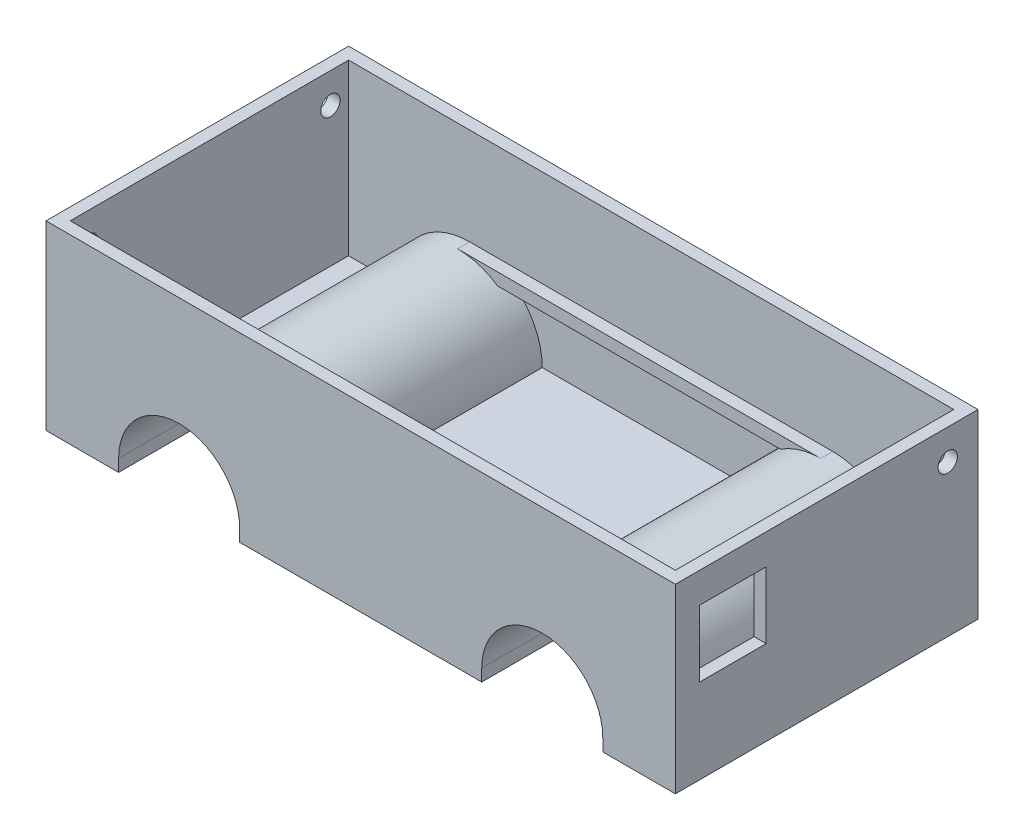
from build123d import *

# Parameters (mm, degrees)
AUFSATZ_LINEAR_AUSTRAGEN1_DEPTH = 50
SKIZZE3_W                       = 104
SKIZZE3_H                       = 2
AUFSATZ_LINEAR_AUSTRAGEN2_DEPTH = 28
SKIZZE4_W                       = 2
SKIZZE4_H                       = 48
AUFSATZ_LINEAR_AUSTRAGEN3_DEPTH = 28
SKIZZE6_W                       = 102
SKIZZE6_H                       = 2
AUFSATZ_LINEAR_AUSTRAGEN4_DEPTH = 28
SKIZZE7_W                       = 2
SKIZZE7_H                       = 46
AUFSATZ_LINEAR_AUSTRAGEN5_DEPTH = 28
SCHNITT_LINEAR_AUSTRAGEN1_DEPTH = 124.501835451
SKIZZE9_W                       = 11
SKIZZE9_H                       = 11
SCHNITT_LINEAR_AUSTRAGEN2_DEPTH = 5
SKIZZE10_W                      = 61.217018751
SKIZZE10_H                      = 2
AUFSATZ_LINEAR_AUSTRAGEN6_DEPTH = 2
SKIZZE11_W                      = 60
SKIZZE11_H                      = 2
AUFSATZ_LINEAR_AUSTRAGEN7_DEPTH = 2
SKIZZE12_R                      = 1.6
SCHNITT_LINEAR_AUSTRAGEN3_DEPTH = 61
SCHNITT_LINEAR_START            = -61
SKIZZE13_R                      = 1.6
SCHNITT_LINEAR_AUSTRAGEN4_DEPTH = 61
SKIZZE14_W                      = 0.314102564
SKIZZE14_H                      = 3.5
SKIZZE14_W_2                    = 1.346153846
SKIZZE14_H_2                    = 0.358974359
SCHNITT_LINEAR_AUSTRAGEN5_DEPTH = 0.5


with BuildPart() as part:
    # Skizze1 → Aufsatz-Linear austragen1 (new body)
    with BuildSketch(Plane.XY):
        with BuildLine():
            Line((37.401569275, 0), (37.401569275, -2))
            Line((37.401569275, -2), (77.401569275, -2))
            Line((77.401569275, -2), (77.401569275, 0))
            ThreePointArc((77.401569275, 0), (87.401569275, 10), (97.401569275, 0))
            Line((97.401569275, 0), (97.401569275, -2))
            Line((97.401569275, -2), (109.401569275, -2))
            Line((109.401569275, -2), (109.401569275, 0))
            Line((109.401569275, 0), (99.401569275, 0))
            ThreePointArc((99.401569275, 0), (87.401569275, 12), (75.401569275, 0))
            Line((75.401569275, 0), (39.401569275, 0))
            ThreePointArc((39.401569275, 0), (27.401569275, 12), (15.401569275, 0))
            Line((15.401569275, 0), (5.401569275, 0))
            Line((5.401569275, 0), (5.401569275, -2))
            Line((5.401569275, -2), (17.401569275, -2))
            Line((17.401569275, -2), (17.401569275, 0))
            ThreePointArc((17.401569275, 0), (27.401569275, 10), (37.401569275, 0))
        make_face()
    extrude(amount=AUFSATZ_LINEAR_AUSTRAGEN1_DEPTH)

    # Skizze3 → Aufsatz-Linear austragen2 (add)
    with BuildSketch(Plane(origin=(0, 0, 0), x_dir=(1, 0, 0), z_dir=(0, 1, 0))):
        with Locations((57.401569275, -1)):
            Rectangle(SKIZZE3_W, SKIZZE3_H)
    extrude(amount=AUFSATZ_LINEAR_AUSTRAGEN2_DEPTH)

    # Skizze4 → Aufsatz-Linear austragen3 (add)
    with BuildSketch(Plane(origin=(0, 0, 0), x_dir=(1, 0, 0), z_dir=(0, 1, 0))):
        with Locations((6.401569275, -26)):
            Rectangle(SKIZZE4_W, SKIZZE4_H)
    extrude(amount=AUFSATZ_LINEAR_AUSTRAGEN3_DEPTH)

    # Skizze6 → Aufsatz-Linear austragen4 (add)
    with BuildSketch(Plane(origin=(0, 0, 0), x_dir=(1, 0, 0), z_dir=(0, 1, 0))):
        with Locations((58.401569275, -49)):
            Rectangle(SKIZZE6_W, SKIZZE6_H)
    extrude(amount=AUFSATZ_LINEAR_AUSTRAGEN4_DEPTH)

    # Skizze7 → Aufsatz-Linear austragen5 (add)
    with BuildSketch(Plane(origin=(0, 0, 0), x_dir=(1, 0, 0), z_dir=(0, 1, 0))):
        with Locations((108.401569275, -25)):
            Rectangle(SKIZZE7_W, SKIZZE7_H)
    extrude(amount=AUFSATZ_LINEAR_AUSTRAGEN5_DEPTH)

    # Skizze8 → Schnitt-Linear austragen1 (cut, through all)
    with BuildSketch(Plane.XY.offset(50)):
        with BuildLine():
            Line((77.401569275, 0), (97.401569275, 0))
            ThreePointArc((97.401569275, 0), (87.401569275, 10), (77.401569275, 0))
        make_face()
        with BuildLine():
            Line((17.401569275, 0), (37.401569275, 0))
            ThreePointArc((37.401569275, 0), (27.401569275, 10), (17.401569275, 0))
        make_face()
    extrude(amount=-SCHNITT_LINEAR_AUSTRAGEN1_DEPTH, mode=Mode.SUBTRACT)

    # Skizze9 → Schnitt-Linear austragen2 (cut)
    with BuildSketch(Plane(origin=(109.401569275, 0, 0), x_dir=(0, 0, -1), z_dir=(1, 0, 0))):
        with Locations((-40.5, 17.5)):
            Rectangle(SKIZZE9_W, SKIZZE9_H)
    extrude(amount=-SCHNITT_LINEAR_AUSTRAGEN2_DEPTH, mode=Mode.SUBTRACT)

    # Skizze10 → Aufsatz-Linear austragen6 (add)
    with BuildSketch(Plane(origin=(0, 0, 48), x_dir=(-1, 0, 0), z_dir=(0, 0, -1))):
        with Locations((-56.7930599, 11)):
            Rectangle(SKIZZE10_W, SKIZZE10_H)
    extrude(amount=AUFSATZ_LINEAR_AUSTRAGEN6_DEPTH)

    # Skizze11 → Aufsatz-Linear austragen7 (add)
    with BuildSketch(Plane.XY.offset(2)):
        with Locations((57.401569275, 11)):
            Rectangle(SKIZZE11_W, SKIZZE11_H)
    extrude(amount=AUFSATZ_LINEAR_AUSTRAGEN7_DEPTH)

    # Skizze12 → Schnitt-Linear austragen3 (cut)
    with BuildSketch(Plane.ZY.offset(-5.401569275)):
        with Locations(Location((5, 23, 0), (0, 0, 270))):
            Circle(SKIZZE12_R)
        with Locations(Location((45, 23, 0), (0, 0, 270))):
            Circle(SKIZZE12_R)
    extrude(amount=-SCHNITT_LINEAR_AUSTRAGEN3_DEPTH, mode=Mode.SUBTRACT)

    # Skizze13 → Schnitt-Linear austragen4 (cut)
    with BuildSketch(Plane(origin=(109.401569275, 0, 0), x_dir=(0, 0, -1), z_dir=(1, 0, 0)).offset(SCHNITT_LINEAR_START)):
        with Locations(Location((-5, 23, 0), (0, 0, 270))):
            Circle(SKIZZE13_R)
    extrude(amount=SCHNITT_LINEAR_AUSTRAGEN4_DEPTH, mode=Mode.SUBTRACT)

    # Skizze14 → Schnitt-Linear austragen5 (cut)
    # profile 1 of 11: a face of its own
    with BuildSketch(Plane.ZY.offset(-5.401569275)):
        Polygon((8.670416664, 11.276592518), (8.670416664, 11.635566877), (10.510160253, 11.635566877), (10.510160253, 11.276592518), (9.74733974, 11.276592518), (9.74733974, 8.135566877), (9.433237176, 8.135566877), (9.433237176, 11.276592518), align=None)
    # profile 2 of 11: a face of its own
    with BuildSketch(Plane.ZY.offset(-5.401569275)):
        Polygon((12.484519228, 11.635566877), (14.099903843, 8.135566877), (13.758457529, 8.135566877), (13.241029644, 9.257361748), (11.654391023, 9.257361748), (11.12223958, 8.135566877), (10.779391023, 8.135566877), (12.439647433, 11.635566877), align=None)
        Polygon((12.458577721, 10.95337537), (11.824763619, 9.616336107), (13.075564901, 9.616336107), align=None, mode=Mode.SUBTRACT)
    # profile 3 of 11: a face of its own
    with BuildSketch(Plane.ZY.offset(-5.401569275)):
        Polygon((14.481314099, 11.635566877), (14.843794067, 11.635566877), (15.760160253, 10.203876171), (16.676526439, 11.635566877), (17.039006407, 11.635566877), (15.941750798, 9.920622966), (17.083878202, 8.135566877), (16.721398234, 8.135566877), (15.760160253, 9.637369761), (14.798922273, 8.135566877), (14.436442305, 8.135566877), (15.57927083, 9.920622966), align=None)
    # profile 4 of 11: a face of its own
    with BuildSketch(Plane.ZY.offset(-5.401569275)):
        with Locations((17.846698715, 9.885566877)):
            Rectangle(SKIZZE14_W, SKIZZE14_H)
    # profile 5 of 11: a face of its own
    with BuildSketch(Plane.ZY.offset(-5.401569275)):
        with Locations((19.260160253, 9.481720723)):
            Rectangle(SKIZZE14_W_2, SKIZZE14_H_2)
    # profile 6 of 11: a face of its own
    with BuildSketch(Plane.ZY.offset(-5.401569275)):
        with BuildLine():
            Line((23.792211535, 11.038211107), (23.522980766, 10.783002774))
            add(Edge.make_bspline(
                [(23.522980766, 10.783002774), (23.474261878, 10.828833637), (23.377985831, 10.9194025), (23.221025589, 11.036913495), (23.057261955, 11.137579595), (22.887549458, 11.219485832), (22.716090904, 11.284838592), (22.545162128, 11.331366732), (22.376516426, 11.36103927), (22.264349208, 11.364587639), (22.209078523, 11.366336107)],
                knots=[0, 0, 0, 0, 1.08915593, 2.152340314, 3.188132944, 4.216796309, 5.218260357, 6.173443236, 7.099959455, 8, 8, 8, 8], degree=3))
            add(Edge.make_bspline(
                [(22.209078523, 11.366336107), (22.175163823, 11.365922501), (22.107422382, 11.365096362), (22.006800438, 11.354552147), (21.907233801, 11.339387283), (21.808910426, 11.317445405), (21.71163914, 11.289636346), (21.615758248, 11.254850883), (21.521088893, 11.214295638), (21.428522812, 11.167433165), (21.338782308, 11.115953318), (21.254025473, 11.058904778), (21.173712074, 10.998115988), (21.099351648, 10.932065008), (21.030516462, 10.861350143), (20.96556809, 10.787286837), (20.906790794, 10.707851618), (20.853699629, 10.624505992), (20.806338011, 10.538713803), (20.764529357, 10.451300813), (20.729432269, 10.362556959), (20.701662814, 10.272370881), (20.67875216, 10.181440291), (20.662634553, 10.089135571), (20.65354783, 9.995357885), (20.65197605, 9.932560627), (20.651185894, 9.900991556)],
                knots=[0, 0, 0, 0, 1.02818874, 2.053710826, 3.065248034, 4.081641283, 5.106893873, 6.131558223, 7.173050175, 8.228653731, 9.27666206, 10.308777013, 11.325269123, 12.329503258, 13.32196095, 14.316845687, 15.314881793, 16.315733098, 17.311955233, 18.285320748, 19.252783886, 20.203351036, 21.145449891, 22.095197417, 23.042428769, 24, 24, 24, 24], degree=3))
            add(Edge.make_bspline(
                [(20.651185894, 9.900991556), (20.651941613, 9.868720739), (20.653450986, 9.804267225), (20.663111305, 9.708073153), (20.681039546, 9.61330775), (20.705007254, 9.519659617), (20.73498807, 9.426968369), (20.772360736, 9.335635859), (20.816626337, 9.245665468), (20.867862889, 9.157867851), (20.924049092, 9.072344828), (20.986992173, 8.991785306), (21.053852757, 8.915116529), (21.127066656, 8.844040765), (21.204286199, 8.776656869), (21.287818475, 8.714821347), (21.376020935, 8.657343124), (21.469028147, 8.604946604), (21.565830929, 8.558138069), (21.665087683, 8.516514172), (21.767115498, 8.482234835), (21.871378188, 8.454296731), (21.977751459, 8.431396434), (22.086775262, 8.416663954), (22.197647971, 8.405973123), (22.272386603, 8.405191453), (22.310040061, 8.404797646)],
                knots=[0, 0, 0, 0, 0.93586088, 1.869166235, 2.799637598, 3.729985548, 4.670839027, 5.622275134, 6.589130586, 7.576015415, 8.568469353, 9.55398029, 10.53834874, 11.515998671, 12.510579167, 13.508179873, 14.527009472, 15.561807829, 16.601455013, 17.643573243, 18.680854198, 19.719860599, 20.772568776, 21.833555941, 22.908541556, 24, 24, 24, 24], degree=3))
            add(Edge.make_bspline(
                [(22.310040061, 8.404797646), (22.355418408, 8.405746222), (22.444526165, 8.407608906), (22.575512608, 8.422109195), (22.701315679, 8.444755989), (22.821581882, 8.477921886), (22.936450903, 8.520225561), (23.046343844, 8.571220947), (23.150395503, 8.632864006), (23.248918676, 8.702437873), (23.339675862, 8.779952706), (23.421529986, 8.863597161), (23.493175475, 8.952965228), (23.555680174, 9.047530543), (23.607388829, 9.148075848), (23.649831624, 9.25410841), (23.682364916, 9.365675922), (23.69571989, 9.442767554), (23.702467946, 9.481720723)],
                knots=[0, 0, 0, 0, 1.13008108, 2.219097802, 3.278683437, 4.311054135, 5.322181354, 6.324827112, 7.324222904, 8.330512327, 9.32562643, 10.293043162, 11.24128371, 12.174520618, 13.111833804, 14.052305215, 15.015860969, 16, 16, 16, 16], degree=3))
            Line((23.702467946, 9.481720723), (22.535801279, 9.481720723))
            Line((22.535801279, 9.481720723), (22.535801279, 9.840695082))
            Line((22.535801279, 9.840695082), (24.01657051, 9.840695082))
            add(Edge.make_bspline(
                [(24.01657051, 9.840695082), (24.014864661, 9.773787593), (24.011526008, 9.642837551), (23.988107092, 9.45186728), (23.95029058, 9.271495587), (23.898630268, 9.101532515), (23.831754988, 8.942218923), (23.750382459, 8.793393056), (23.653210338, 8.656016376), (23.543699897, 8.528967372), (23.420799939, 8.41563816), (23.287831319, 8.316032222), (23.144574351, 8.232129607), (22.991164543, 8.163868944), (22.82810411, 8.110594949), (22.65501573, 8.072823373), (22.472134129, 8.050193409), (22.346797452, 8.04730203), (22.282696311, 8.045823287)],
                knots=[0, 0, 0, 0, 1.140356446, 2.231883559, 3.274166699, 4.278491846, 5.25512956, 6.21435461, 7.1637429, 8.11826594, 9.068280886, 10.0076534, 10.945064095, 11.891975133, 12.864533718, 13.863980011, 14.907571808, 16, 16, 16, 16], degree=3))
            add(Edge.make_bspline(
                [(22.282696311, 8.045823287), (22.243186176, 8.046392408), (22.165259455, 8.047514899), (22.050168527, 8.055492246), (21.938250906, 8.067772822), (21.829522897, 8.086317946), (21.723584555, 8.1090326), (21.62096497, 8.138119319), (21.521273228, 8.171788018), (21.424355242, 8.210083692), (21.331090696, 8.254455348), (21.241064179, 8.303764988), (21.153778053, 8.357758348), (21.069826888, 8.417369194), (20.988773267, 8.482151654), (20.911139823, 8.552235573), (20.836491945, 8.627406693), (20.789731481, 8.680785703), (20.766169869, 8.707682261)],
                knots=[0, 0, 0, 0, 1.107784379, 2.184907829, 3.233506516, 4.263428166, 5.276301166, 6.270063455, 7.25232949, 8.225834625, 9.190232166, 10.146266622, 11.1027726, 12.066435141, 13.031522626, 14.010570082, 14.99756817, 16, 16, 16, 16], degree=3))
            add(Edge.make_bspline(
                [(20.766169869, 8.707682261), (20.731983937, 8.750352914), (20.664179524, 8.834985931), (20.576901368, 8.970585876), (20.502499965, 9.110987736), (20.442132143, 9.256582364), (20.394994056, 9.407233577), (20.361187803, 9.562748868), (20.341380514, 9.723328499), (20.338526977, 9.831993764), (20.33708333, 9.88696912)],
                knots=[0, 0, 0, 0, 1.023165419, 2.029347347, 3.013907458, 3.994755782, 4.975994455, 5.96558838, 6.970761222, 8, 8, 8, 8], degree=3))
            add(Edge.make_bspline(
                [(20.33708333, 9.88696912), (20.337615568, 9.928135373), (20.33867328, 10.00994468), (20.351498796, 10.131401988), (20.369900214, 10.25070268), (20.396947269, 10.367749236), (20.431043534, 10.482619828), (20.47359702, 10.595367792), (20.523141916, 10.706059663), (20.580727412, 10.813933531), (20.644811871, 10.917557944), (20.714362092, 11.016515748), (20.790365692, 11.109004813), (20.871581491, 11.196196461), (20.958978482, 11.276995308), (21.051737905, 11.352149419), (21.149931248, 11.421759604), (21.253867428, 11.484729439), (21.361995113, 11.54129306), (21.474055114, 11.590882271), (21.590013225, 11.631865587), (21.709000703, 11.666639366), (21.831918203, 11.692354507), (21.95787374, 11.711003252), (22.087523852, 11.723763852), (22.175159881, 11.724790108), (22.219595349, 11.725310466)],
                knots=[0, 0, 0, 0, 1.008945113, 2.00506715, 2.99143336, 3.967273523, 4.948097931, 5.927297278, 6.919902385, 7.919676788, 8.923139349, 9.905703106, 10.883022732, 11.856032218, 12.825136022, 13.798837087, 14.781400844, 15.773989409, 16.776158564, 17.77167057, 18.775803737, 19.789618931, 20.80898985, 21.851988756, 22.910860228, 24, 24, 24, 24], degree=3))
            add(Edge.make_bspline(
                [(22.219595349, 11.725310466), (22.255833593, 11.724730975), (22.327689772, 11.723581911), (22.434615504, 11.715617263), (22.539888519, 11.702993381), (22.643664909, 11.685766595), (22.745591275, 11.662302904), (22.84595798, 11.63422462), (22.944910517, 11.601532797), (23.042138766, 11.562543951), (23.138296482, 11.518290326), (23.233918322, 11.468476903), (23.328677568, 11.412251899), (23.42273855, 11.349448363), (23.516694408, 11.281144945), (23.60905905, 11.205388122), (23.702061994, 11.125165366), (23.761863808, 11.067483182), (23.792211535, 11.038211107)],
                knots=[0, 0, 0, 0, 0.985871117, 1.954866573, 2.915460327, 3.869826059, 4.81536089, 5.759505086, 6.70452669, 7.649098992, 8.607881297, 9.583363685, 10.581137262, 11.603961102, 12.659522466, 13.73993555, 14.853081303, 16, 16, 16, 16], degree=3))
        make_face()
    # profile 7 of 11: a face of its own
    with BuildSketch(Plane.ZY.offset(-5.401569275)):
        Polygon((26.170416664, 11.635566877), (27.785801279, 8.135566877), (27.444354965, 8.135566877), (26.92692708, 9.257361748), (25.340288458, 9.257361748), (24.808137016, 8.135566877), (24.465288458, 8.135566877), (26.125544869, 11.635566877), align=None)
        Polygon((26.144475157, 10.95337537), (25.510661055, 9.616336107), (26.761462337, 9.616336107), align=None, mode=Mode.SUBTRACT)
    # profile 8 of 11: a face of its own
    with BuildSketch(Plane.ZY.offset(-5.401569275)):
        with BuildLine():
            Line((28.414006407, 11.635566877), (29.11442708, 11.635566877))
            add(Edge.make_bspline(
                [(29.11442708, 11.635566877), (29.161168209, 11.635411291), (29.250916353, 11.635112548), (29.379489624, 11.633446785), (29.496316721, 11.62867243), (29.60133656, 11.624563846), (29.694547215, 11.617071905), (29.776234506, 11.609911258), (29.846022203, 11.600537597), (29.888268054, 11.591832174), (29.90739583, 11.587890595)],
                knots=[0, 0, 0, 0, 1.410062039, 2.707475311, 3.878576406, 4.937260626, 5.877586885, 6.699081471, 7.410979367, 8, 8, 8, 8], degree=3))
            add(Edge.make_bspline(
                [(29.90739583, 11.587890595), (29.933002454, 11.581563829), (29.983669444, 11.569045266), (30.05661951, 11.542585665), (30.126133834, 11.51196604), (30.191923658, 11.47600232), (30.253659449, 11.43442754), (30.31197776, 11.387959418), (30.367143224, 11.336852212), (30.416924854, 11.27981737), (30.463863905, 11.219980861), (30.503452532, 11.155277104), (30.537579012, 11.087615576), (30.564749529, 11.016308159), (30.586627502, 10.942046387), (30.602053741, 10.86415759), (30.611304929, 10.782996615), (30.612246785, 10.727638706), (30.612724356, 10.69956928)],
                knots=[0, 0, 0, 0, 1.027469482, 2.033020251, 3.019912614, 3.986113645, 4.951240523, 5.91722682, 6.890402269, 7.87763091, 8.8651537, 9.85103654, 10.82876324, 11.815024772, 12.821070561, 13.842952187, 14.906261191, 16, 16, 16, 16], degree=3))
            add(Edge.make_bspline(
                [(30.612724356, 10.69956928), (30.611255358, 10.652934176), (30.608388962, 10.561937008), (30.581663858, 10.429876127), (30.537887339, 10.306686812), (30.47756405, 10.192524174), (30.400744574, 10.089613529), (30.308419783, 9.999223073), (30.200538171, 9.923583161), (30.100108855, 9.871130356), (30.011394656, 9.837537447), (29.938361343, 9.813901089), (29.858694365, 9.795639123), (29.773157031, 9.779278992), (29.681393375, 9.766927297), (29.583623336, 9.757880703), (29.479777184, 9.752226654), (29.408438115, 9.751384649), (29.371738779, 9.750951492)],
                knots=[0, 0, 0, 0, 1.260483769, 2.459530307, 3.627416485, 4.787058657, 5.939039949, 7.08810263, 8.267026773, 9.491475466, 10.141966685, 10.831826277, 11.566392101, 12.351337768, 13.187381173, 14.07005841, 15.007169909, 16, 16, 16, 16], degree=3))
            Line((29.371738779, 9.750951492), (30.657596151, 8.135566877))
            Line((30.657596151, 8.135566877), (30.269174676, 8.135566877))
            Line((30.269174676, 8.135566877), (28.983317305, 9.750951492))
            Line((28.983317305, 9.750951492), (28.728108971, 9.750951492))
            Line((28.728108971, 9.750951492), (28.728108971, 8.135566877))
            Line((28.728108971, 8.135566877), (28.414006407, 8.135566877))
            Line((28.414006407, 8.135566877), (28.414006407, 11.635566877))
        make_face()
        with BuildLine():
            Line((28.728108971, 11.276592518), (28.728108971, 10.109925851))
            Line((28.728108971, 10.109925851), (29.368934292, 10.105017998))
            add(Edge.make_bspline(
                [(29.368934292, 10.105017998), (29.398854331, 10.105004762), (29.456847888, 10.104979105), (29.540748553, 10.108972882), (29.618868664, 10.1135162), (29.690909416, 10.120465545), (29.756902992, 10.129421617), (29.816816405, 10.140624601), (29.870747457, 10.153676664), (29.933645995, 10.17387829), (30.003882527, 10.205884308), (30.080213987, 10.252449807), (30.145216324, 10.311018926), (30.200134187, 10.377992382), (30.244263618, 10.451628631), (30.275375672, 10.531045), (30.295118115, 10.614236598), (30.29744666, 10.671414706), (30.298621792, 10.700270402)],
                knots=[0, 0, 0, 0, 1.146690395, 2.22261258, 3.21895312, 4.145990853, 4.996080663, 5.770904154, 6.481378293, 7.121626537, 8.300444488, 9.431385265, 10.535395872, 11.636531494, 12.74115979, 13.810798291, 14.895190096, 16, 16, 16, 16], degree=3))
            add(Edge.make_bspline(
                [(30.298621792, 10.700270402), (30.297419671, 10.728416976), (30.295037505, 10.784193215), (30.275588737, 10.865849125), (30.242699355, 10.942916075), (30.198377118, 11.01508056), (30.144377963, 11.080586296), (30.08106015, 11.136633449), (30.010154955, 11.182882914), (29.943883756, 11.212437294), (29.884649544, 11.230557147), (29.833219884, 11.243308311), (29.775108406, 11.25355278), (29.710032947, 11.261760841), (29.638271317, 11.268815785), (29.559460666, 11.273567564), (29.474123885, 11.276381428), (29.414976954, 11.276520517), (29.384358971, 11.276592518)],
                knots=[0, 0, 0, 0, 1.101028733, 2.181837193, 3.264309656, 4.369019818, 5.486613113, 6.575447106, 7.666700264, 8.788928104, 9.402425223, 10.0903467, 10.862060571, 11.710948788, 12.657782767, 13.684531032, 14.801375019, 16, 16, 16, 16], degree=3))
            Line((29.384358971, 11.276592518), (28.728108971, 11.276592518))
        make_face(mode=Mode.SUBTRACT)
    # profile 9 of 11: a face of its own
    with BuildSketch(Plane.ZY.offset(-5.401569275)):
        Polygon((32.811442305, 11.635566877), (34.42682692, 8.135566877), (34.085380606, 8.135566877), (33.567952721, 9.257361748), (31.981314099, 9.257361748), (31.449162657, 8.135566877), (31.106314099, 8.135566877), (32.76657051, 11.635566877), align=None)
        Polygon((32.785500798, 10.95337537), (32.151686696, 9.616336107), (33.402487978, 9.616336107), align=None, mode=Mode.SUBTRACT)
    # profile 10 of 11: a face of its own
    with BuildSketch(Plane.ZY.offset(-5.401569275)):
        with BuildLine():
            Line((38.330673074, 11.038211107), (38.061442305, 10.783002774))
            add(Edge.make_bspline(
                [(38.061442305, 10.783002774), (38.012723416, 10.828833637), (37.91644737, 10.9194025), (37.759487127, 11.036913495), (37.595723493, 11.137579595), (37.426010996, 11.219485832), (37.254552443, 11.284838592), (37.083623666, 11.331366732), (36.914977965, 11.36103927), (36.802810746, 11.364587639), (36.747540061, 11.366336107)],
                knots=[0, 0, 0, 0, 1.08915593, 2.152340314, 3.188132944, 4.216796309, 5.218260357, 6.173443236, 7.099959455, 8, 8, 8, 8], degree=3))
            add(Edge.make_bspline(
                [(36.747540061, 11.366336107), (36.713625361, 11.365922501), (36.64588392, 11.365096362), (36.545261976, 11.354552147), (36.445695339, 11.339387283), (36.347371965, 11.317445405), (36.250100678, 11.289636346), (36.154219786, 11.254850883), (36.059550431, 11.214295638), (35.96698435, 11.167433165), (35.877243847, 11.115953318), (35.792487011, 11.058904778), (35.712173612, 10.998115988), (35.637813187, 10.932065008), (35.568978, 10.861350143), (35.504029628, 10.787286837), (35.445252332, 10.707851618), (35.392161167, 10.624505992), (35.344799549, 10.538713803), (35.302990895, 10.451300813), (35.267893807, 10.362556959), (35.240124352, 10.272370881), (35.217213698, 10.181440291), (35.201096091, 10.089135571), (35.192009369, 9.995357885), (35.190437589, 9.932560627), (35.189647433, 9.900991556)],
                knots=[0, 0, 0, 0, 1.02818874, 2.053710826, 3.065248034, 4.081641283, 5.106893873, 6.131558223, 7.173050175, 8.228653731, 9.27666206, 10.308777013, 11.325269123, 12.329503258, 13.32196095, 14.316845687, 15.314881793, 16.315733098, 17.311955233, 18.285320748, 19.252783886, 20.203351036, 21.145449891, 22.095197417, 23.042428769, 24, 24, 24, 24], degree=3))
            add(Edge.make_bspline(
                [(35.189647433, 9.900991556), (35.190403151, 9.868720739), (35.191912524, 9.804267225), (35.201572844, 9.708073153), (35.219501084, 9.61330775), (35.243468793, 9.519659617), (35.273449609, 9.426968369), (35.310822275, 9.335635859), (35.355087875, 9.245665468), (35.406324427, 9.157867851), (35.462510631, 9.072344828), (35.525453712, 8.991785306), (35.592314295, 8.915116529), (35.665528195, 8.844040765), (35.742747737, 8.776656869), (35.826280013, 8.714821347), (35.914482474, 8.657343124), (36.007489685, 8.604946604), (36.104292468, 8.558138069), (36.203549221, 8.516514172), (36.305577037, 8.482234835), (36.409839726, 8.454296731), (36.516212998, 8.431396434), (36.625236801, 8.416663954), (36.736109509, 8.405973123), (36.810848141, 8.405191453), (36.848501599, 8.404797646)],
                knots=[0, 0, 0, 0, 0.93586088, 1.869166235, 2.799637598, 3.729985548, 4.670839027, 5.622275134, 6.589130586, 7.576015415, 8.568469353, 9.55398029, 10.53834874, 11.515998671, 12.510579167, 13.508179873, 14.527009472, 15.561807829, 16.601455013, 17.643573243, 18.680854198, 19.719860599, 20.772568776, 21.833555941, 22.908541556, 24, 24, 24, 24], degree=3))
            add(Edge.make_bspline(
                [(36.848501599, 8.404797646), (36.893879947, 8.405746222), (36.982987704, 8.407608906), (37.113974147, 8.422109195), (37.239777217, 8.444755989), (37.360043421, 8.477921886), (37.474912441, 8.520225561), (37.584805383, 8.571220947), (37.688857041, 8.632864006), (37.787380215, 8.702437873), (37.8781374, 8.779952706), (37.959991524, 8.863597161), (38.031637014, 8.952965228), (38.094141713, 9.047530543), (38.145850367, 9.148075848), (38.188293162, 9.25410841), (38.220826454, 9.365675922), (38.234181429, 9.442767554), (38.240929484, 9.481720723)],
                knots=[0, 0, 0, 0, 1.13008108, 2.219097802, 3.278683437, 4.311054135, 5.322181354, 6.324827112, 7.324222904, 8.330512327, 9.32562643, 10.293043162, 11.24128371, 12.174520618, 13.111833804, 14.052305215, 15.015860969, 16, 16, 16, 16], degree=3))
            Line((38.240929484, 9.481720723), (37.074262817, 9.481720723))
            Line((37.074262817, 9.481720723), (37.074262817, 9.840695082))
            Line((37.074262817, 9.840695082), (38.555032048, 9.840695082))
            add(Edge.make_bspline(
                [(38.555032048, 9.840695082), (38.5533262, 9.773787593), (38.549987546, 9.642837551), (38.526568631, 9.45186728), (38.488752118, 9.271495587), (38.437091807, 9.101532515), (38.370216526, 8.942218923), (38.288843998, 8.793393056), (38.191671877, 8.656016376), (38.082161435, 8.528967372), (37.959261477, 8.41563816), (37.826292858, 8.316032222), (37.683035889, 8.232129607), (37.529626082, 8.163868944), (37.366565648, 8.110594949), (37.193477268, 8.072823373), (37.010595668, 8.050193409), (36.885258991, 8.04730203), (36.821157849, 8.045823287)],
                knots=[0, 0, 0, 0, 1.140356446, 2.231883559, 3.274166699, 4.278491846, 5.25512956, 6.21435461, 7.1637429, 8.11826594, 9.068280886, 10.0076534, 10.945064095, 11.891975133, 12.864533718, 13.863980011, 14.907571808, 16, 16, 16, 16], degree=3))
            add(Edge.make_bspline(
                [(36.821157849, 8.045823287), (36.781647714, 8.046392408), (36.703720993, 8.047514899), (36.588630065, 8.055492246), (36.476712445, 8.067772822), (36.367984436, 8.086317946), (36.262046094, 8.1090326), (36.159426509, 8.138119319), (36.059734767, 8.171788018), (35.962816781, 8.210083692), (35.869552234, 8.254455348), (35.779525717, 8.303764988), (35.692239591, 8.357758348), (35.608288426, 8.417369194), (35.527234805, 8.482151654), (35.449601361, 8.552235573), (35.374953483, 8.627406693), (35.32819302, 8.680785703), (35.304631407, 8.707682261)],
                knots=[0, 0, 0, 0, 1.107784379, 2.184907829, 3.233506516, 4.263428166, 5.276301166, 6.270063455, 7.25232949, 8.225834625, 9.190232166, 10.146266622, 11.1027726, 12.066435141, 13.031522626, 14.010570082, 14.99756817, 16, 16, 16, 16], degree=3))
            add(Edge.make_bspline(
                [(35.304631407, 8.707682261), (35.270445475, 8.750352914), (35.202641063, 8.834985931), (35.115362906, 8.970585876), (35.040961503, 9.110987736), (34.980593681, 9.256582364), (34.933455595, 9.407233577), (34.899649342, 9.562748868), (34.879842053, 9.723328499), (34.876988515, 9.831993764), (34.875544869, 9.88696912)],
                knots=[0, 0, 0, 0, 1.023165419, 2.029347347, 3.013907458, 3.994755782, 4.975994455, 5.96558838, 6.970761222, 8, 8, 8, 8], degree=3))
            add(Edge.make_bspline(
                [(34.875544869, 9.88696912), (34.876077107, 9.928135373), (34.877134819, 10.00994468), (34.889960335, 10.131401988), (34.908361753, 10.25070268), (34.935408807, 10.367749236), (34.969505072, 10.482619828), (35.012058558, 10.595367792), (35.061603454, 10.706059663), (35.11918895, 10.813933531), (35.18327341, 10.917557944), (35.25282363, 11.016515748), (35.32882723, 11.109004813), (35.41004303, 11.196196461), (35.49744002, 11.276995308), (35.590199444, 11.352149419), (35.688392787, 11.421759604), (35.792328967, 11.484729439), (35.900456651, 11.54129306), (36.012516652, 11.590882271), (36.128474763, 11.631865587), (36.247462241, 11.666639366), (36.370379742, 11.692354507), (36.496335279, 11.711003252), (36.625985391, 11.723763852), (36.71362142, 11.724790108), (36.758056888, 11.725310466)],
                knots=[0, 0, 0, 0, 1.008945113, 2.00506715, 2.99143336, 3.967273523, 4.948097931, 5.927297278, 6.919902385, 7.919676788, 8.923139349, 9.905703106, 10.883022732, 11.856032218, 12.825136022, 13.798837087, 14.781400844, 15.773989409, 16.776158564, 17.77167057, 18.775803737, 19.789618931, 20.80898985, 21.851988756, 22.910860228, 24, 24, 24, 24], degree=3))
            add(Edge.make_bspline(
                [(36.758056888, 11.725310466), (36.794295132, 11.724730975), (36.86615131, 11.723581911), (36.973077043, 11.715617263), (37.078350057, 11.702993381), (37.182126447, 11.685766595), (37.284052813, 11.662302904), (37.384419519, 11.63422462), (37.483372055, 11.601532797), (37.580600304, 11.562543951), (37.67675802, 11.518290326), (37.772379861, 11.468476903), (37.867139107, 11.412251899), (37.961200088, 11.349448363), (38.055155946, 11.281144945), (38.147520588, 11.205388122), (38.240523533, 11.125165366), (38.300325347, 11.067483182), (38.330673074, 11.038211107)],
                knots=[0, 0, 0, 0, 0.985871117, 1.954866573, 2.915460327, 3.869826059, 4.81536089, 5.759505086, 6.70452669, 7.649098992, 8.607881297, 9.583363685, 10.581137262, 11.603961102, 12.659522466, 13.73993555, 14.853081303, 16, 16, 16, 16], degree=3))
        make_face()
    # profile 11 of 11: a face of its own
    with BuildSketch(Plane.ZY.offset(-5.401569275)):
        Polygon((39.272980766, 11.635566877), (41.24733974, 11.635566877), (41.24733974, 11.276592518), (39.58708333, 11.276592518), (39.58708333, 10.199669441), (41.24733974, 10.199669441), (41.24733974, 9.840695082), (39.58708333, 9.840695082), (39.58708333, 8.494541236), (41.24733974, 8.494541236), (41.24733974, 8.135566877), (39.272980766, 8.135566877), align=None)
    extrude(amount=-SCHNITT_LINEAR_AUSTRAGEN5_DEPTH, mode=Mode.SUBTRACT)


solid = part.part
